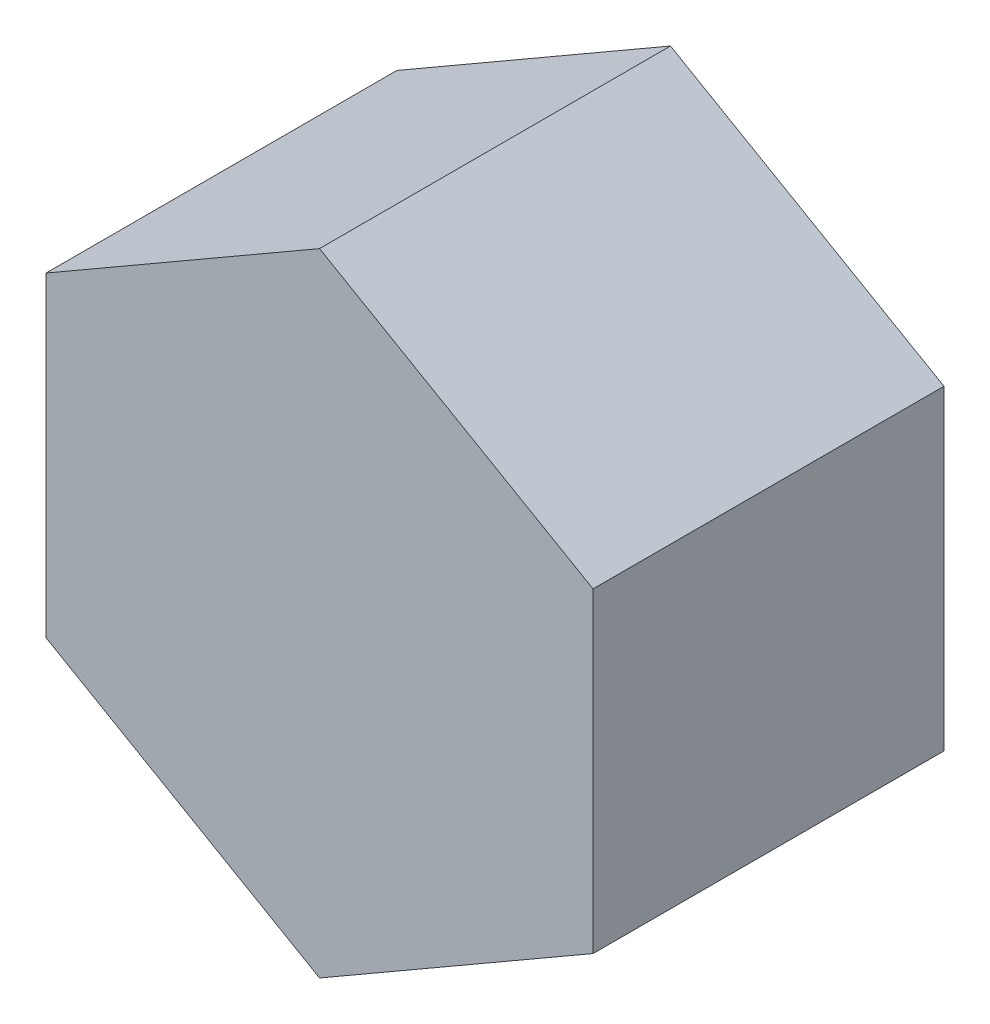
from build123d import *

# Parameters (mm, degrees)
BOSS_EXTRUDE1_DEPTH = 1
SKETCH2_R           = 2.775
BOSS_EXTRUDE2_DEPTH = 3
BOSS_EXTRUDE3_DEPTH = 2


with BuildPart() as part:
    # Sketch1 → Boss-Extrude1 (new body)
    with BuildSketch(Plane.XY):
        Polygon((-1.71944816, -3.077706513), (-1.71944816, -1.63433084), (-2.96944816, -0.912643004), (-4.21944816, -1.63433084), (-4.21944816, -3.077706513), (-2.96944816, -3.79939435), align=None)
    extrude(amount=BOSS_EXTRUDE1_DEPTH)



with BuildPart() as body_2:
    # Sketch2 → Boss-Extrude2 (new body)
    with BuildSketch(Plane.XY.offset(1)):
        Polygon((-2.96944816, -6.856018677), (0.927666157, -4.606018677), (0.927666157, -0.106018677), (-2.96944816, 2.143981323), (-6.866562477, -0.106018677), (-6.866562477, -4.606018677), align=None)
        with Locations((-2.96944816, -2.356018677)):
            Circle(SKETCH2_R, mode=Mode.SUBTRACT)
    extrude(amount=-BOSS_EXTRUDE2_DEPTH)


with BuildPart() as part_1:
    add(part.part)

    add(body_2.part)  # Boss-Extrude3 merges body 2
    # Sketch3 → Boss-Extrude3 (add)
    with BuildSketch(Plane.XY.offset(1)):
        Polygon((-2.96944816, -6.856018677), (0.927666157, -4.606018677), (0.927666157, -0.106018677), (-2.96944816, 2.143981323), (-6.866562477, -0.106018677), (-6.866562477, -4.606018677), align=None)
    extrude(amount=BOSS_EXTRUDE3_DEPTH)


solid = part_1.part
